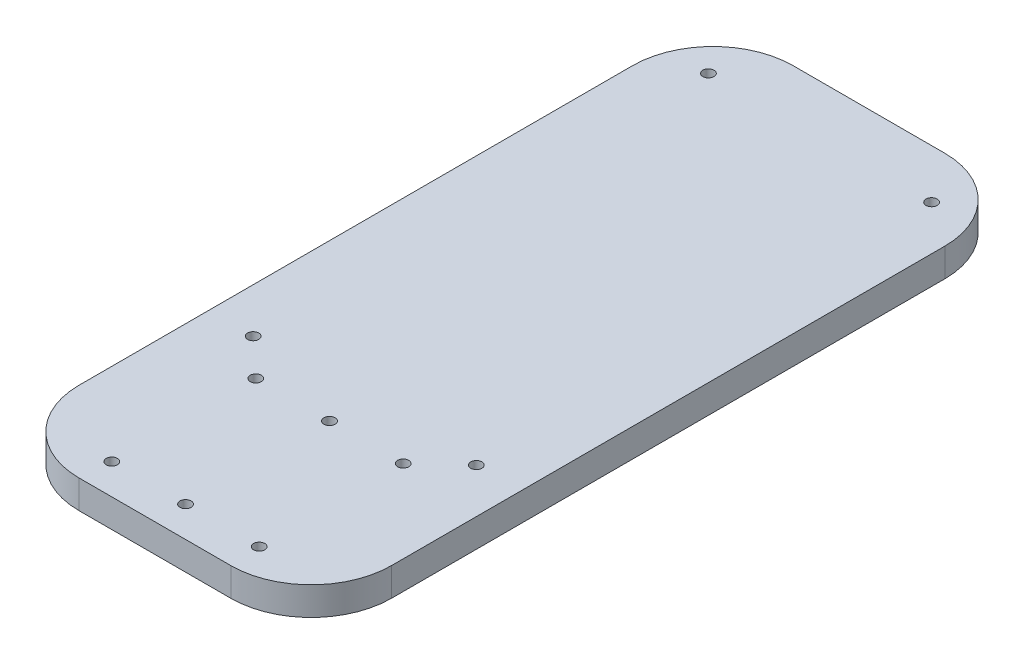
from build123d import *

# Parameters (mm, degrees)
SKETCH1_W           = 70
SKETCH1_H           = 160
BOSS_EXTRUDE1_DEPTH = 6.35
SKETCH7_W           = 4.699
SKETCH7_H           = 2.5
FILLET1_R           = 18
SKETCH11_R          = 1.65
CUT_EXTRUDE4_DEPTH  = 3.5
SKETCH14_R          = 1.25
CUT_EXTRUDE7_DEPTH  = 3.5


with BuildPart() as part:
    # Sketch1 → Boss-Extrude1 (new body)
    with BuildSketch(Plane(origin=(0, 0, 0), x_dir=(1, 0, 0), z_dir=(0, 1, 0))):
        Rectangle(SKETCH1_W, SKETCH1_H)
    extrude(amount=BOSS_EXTRUDE1_DEPTH)

    # Cut-Sweep2: sweep along a path in Sketch2
    with BuildLine(Plane(origin=(0, 0, 0), x_dir=(1, 0, 0), z_dir=(0, 1, 0))) as cut_sweep2_path:
        Line((-13, 73), (13, 73))
        ThreePointArc((13, 73), (23.606601718, 68.606601718), (28, 58))
        Line((28, 58), (28, -58))
        ThreePointArc((28, -58), (23.606601718, -68.606601718), (13, -73))
        Line((13, -73), (-13, -73))
        ThreePointArc((-13, -73), (-23.606601718, -68.606601718), (-28, -58))
        Line((-28, -58), (-28, 58))
        ThreePointArc((-28, 58), (-23.606601718, 68.606601718), (-13, 73))
    # Sketch7 → Cut-Sweep2 (sweep, cut)
    with BuildSketch(Plane.XY):
        with Locations((28, 1.25)):
            Rectangle(SKETCH7_W, SKETCH7_H)
    sweep(path=cut_sweep2_path.line, mode=Mode.SUBTRACT)

    # Fillet1
    fillet1_edges = [part.edges().sort_by_distance(p)[0] for p in [
        (-35, 3.175, 80),
        (-35, 3.175, -80),
        (35, 3.175, -80),
        (35, 3.175, 80),
    ]]
    fillet(fillet1_edges, radius=FILLET1_R)

    # Sketch11 → Cut-Extrude4 (cut)
    with BuildSketch(Plane.XZ):
        with Locations((16.535533906, 61.535533906)):
            Circle(SKETCH11_R)
        with Locations((18, -20.511844635)):
            Circle(SKETCH11_R)
        with Locations((18, 20.511844635)):
            Circle(SKETCH11_R)
        with Locations((-16.535533906, 61.535533906)):
            Circle(SKETCH11_R)
        with Locations((-18, 20.511844635)):
            Circle(SKETCH11_R)
        with Locations((16.535533906, -61.535533906)):
            Circle(SKETCH11_R)
        with Locations((-18, -20.511844635)):
            Circle(SKETCH11_R)
        with Locations((-16.535533906, -61.535533906)):
            Circle(SKETCH11_R)
    extrude(amount=-CUT_EXTRUDE4_DEPTH, mode=Mode.SUBTRACT)

    # Sketch14 → Cut-Extrude7 (cut)
    with BuildSketch(Plane(origin=(0, 6.35, 0), x_dir=(1, 0, 0), z_dir=(0, 1, 0))):
        with Locations((-16.51, -40.888057962)):
            Circle(SKETCH14_R)
        with Locations((0, -40.888057962)):
            Circle(SKETCH14_R)
        with Locations((16.51, -40.888057962)):
            Circle(SKETCH14_R)
        with Locations((16.51, -73.146057962)):
            Circle(SKETCH14_R)
        with Locations((0, -73.146057962)):
            Circle(SKETCH14_R)
        with Locations((-16.51, -73.146057962)):
            Circle(SKETCH14_R)
        with Locations((-25, -32.987253412)):
            Circle(SKETCH14_R)
        with Locations((25, -32.987253412)):
            Circle(SKETCH14_R)
        with Locations((25, 69.012746588)):
            Circle(SKETCH14_R)
        with Locations((-25, 69.012746588)):
            Circle(SKETCH14_R)
    extrude(amount=-CUT_EXTRUDE7_DEPTH, mode=Mode.SUBTRACT)


solid = part.part
